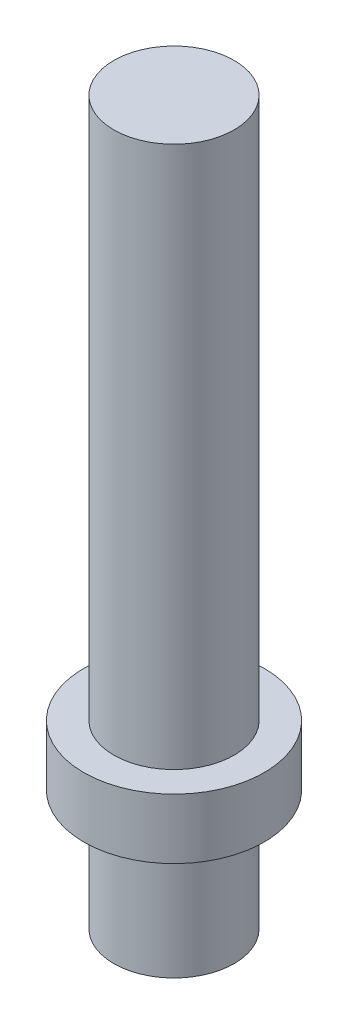
from build123d import *

# Parameters (mm, degrees)
SKETCH1_R           = 1.5875
BOSS_EXTRUDE1_DEPTH = 3.175
SKETCH2_R           = 2.38125
BOSS_EXTRUDE2_DEPTH = 1.5875
SKETCH3_R           = 1.5875
BOSS_EXTRUDE3_DEPTH = 14.2875


with BuildPart() as part:
    # Sketch1 → Boss-Extrude1 (new body)
    with BuildSketch(Plane(origin=(0, 0, 0), x_dir=(1, 0, 0), z_dir=(0, 1, 0))):
        with Locations(Location((0, 0, 0), (0, 0, 270))):
            Circle(SKETCH1_R)
    extrude(amount=BOSS_EXTRUDE1_DEPTH)

    # Sketch2 → Boss-Extrude2 (add)
    with BuildSketch(Plane(origin=(0, 3.175, 0), x_dir=(1, 0, 0), z_dir=(0, 1, 0))):
        with Locations(Location((0, 0, 0), (0, 0, 270))):
            Circle(SKETCH2_R)
    extrude(amount=BOSS_EXTRUDE2_DEPTH)

    # Sketch3 → Boss-Extrude3 (add)
    with BuildSketch(Plane(origin=(0, 4.7625, 0), x_dir=(1, 0, 0), z_dir=(0, 1, 0))):
        with Locations(Location((0, 0, 0), (0, 0, 270))):
            Circle(SKETCH3_R)
    extrude(amount=BOSS_EXTRUDE3_DEPTH)


solid = part.part
